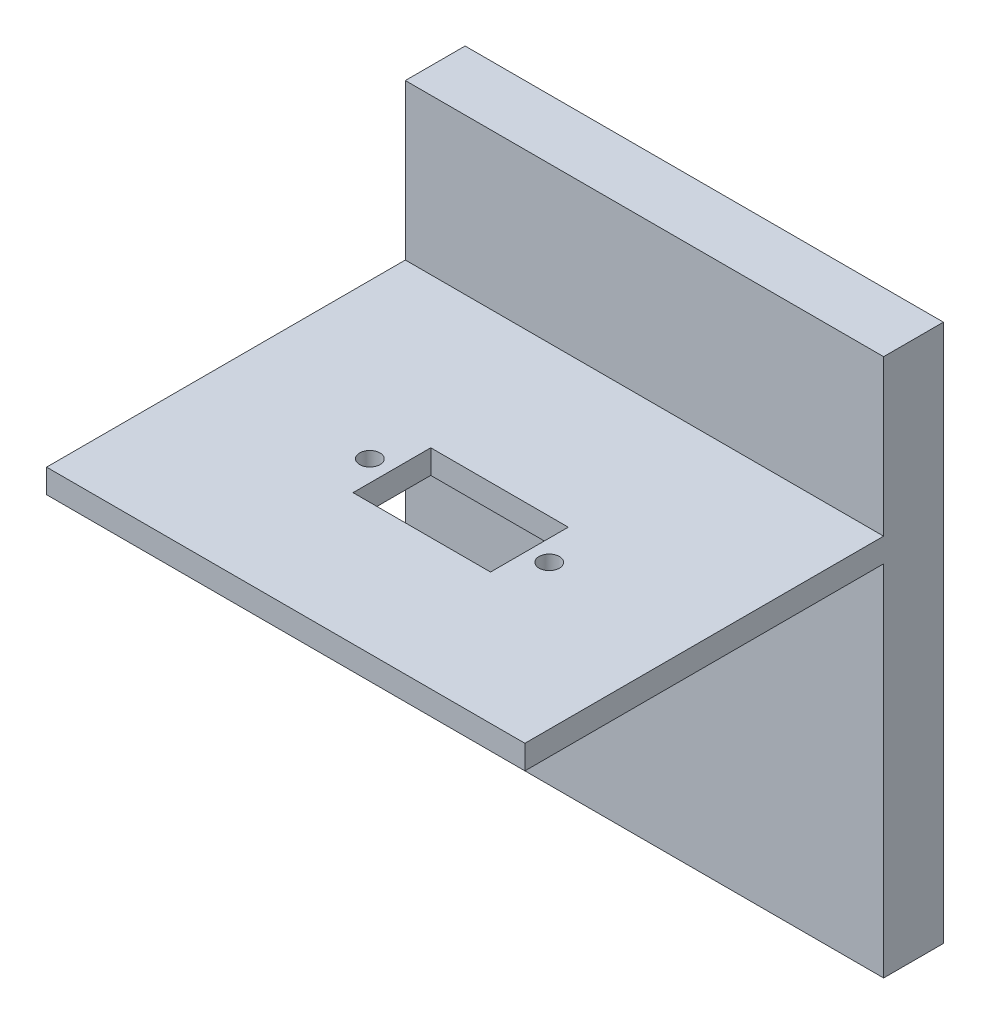
from build123d import *

# Parameters (mm, degrees)
BASE_DEPTH         = 10
SKETCH2_W          = 80
SKETCH2_H          = 4
SHELF_DEPTH        = 60
SKETCH5_R          = 1.7
SKETCH5_W          = 23
SKETCH5_H          = 13
CUT_EXTRUDE2_DEPTH = 10


with BuildPart() as part:
    # Sketch1 → Base (new body)
    with BuildSketch(Plane.XY):
        Polygon((-48.262081784, 36.356877323), (-48.262081784, -23.643122677), (31.737918216, -23.643122677), (31.737918216, 36.356877323), (31.737918216, 66.356877323), (-48.262081784, 66.356877323), align=None)
    extrude(amount=BASE_DEPTH)

    # Sketch2 → Shelf (add)
    with BuildSketch(Plane.XY.offset(10)):
        with Locations((-8.262081784, 38.356877323)):
            Rectangle(SKETCH2_W, SKETCH2_H)
    extrude(amount=SHELF_DEPTH)

    # Sketch5 → Cut-Extrude2 (cut)
    with BuildSketch(Plane(origin=(0, 40.356877323, 0), x_dir=(1, 0, 0), z_dir=(0, 1, 0))):
        with Locations(Location((-22.437854868, -41.756424537, 0), (0, 0, 270))):
            Circle(SKETCH5_R)
        with Locations(Location((7.562145132, -41.756424537, 0), (0, 0, 270))):
            Circle(SKETCH5_R)
        with Locations((-7.437854868, -41.569973221)):
            Rectangle(SKETCH5_W, SKETCH5_H)
    extrude(amount=-CUT_EXTRUDE2_DEPTH, mode=Mode.SUBTRACT)


solid = part.part
